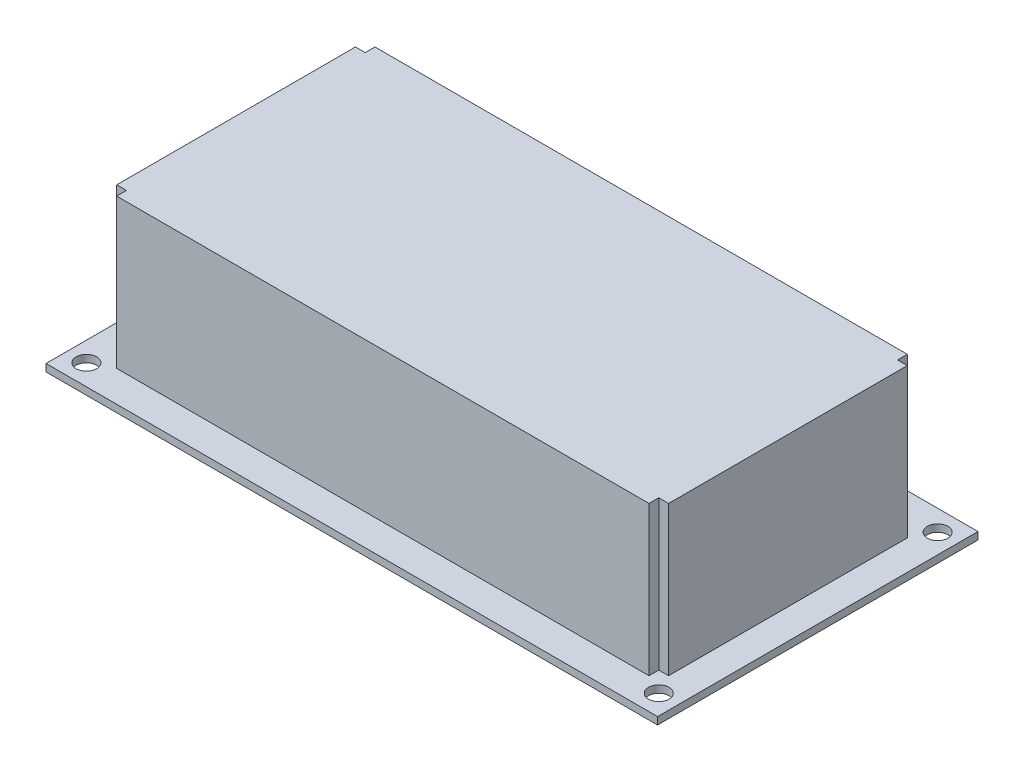
from build123d import *

# Parameters (mm, degrees)
SKETCH_1_W        = 125
SKETCH_1_H        = 65.5
EXTRUDE_1_DEPTH   = 1.5
HOLE_WIZARD_M41_D = 4.2
EXTRUDE_2_DEPTH   = 30.5


with BuildPart() as part:
    # Эскиз1 → Бобышка-Вытянуть1 (new body)
    with BuildSketch(Plane(origin=(0, 0, 0), x_dir=(1, 0, 0), z_dir=(0, 1, 0))):
        Rectangle(SKETCH_1_W, SKETCH_1_H)
    extrude(amount=EXTRUDE_1_DEPTH)

    # Сверло под метчик  спиральное M41 (through all)
    with Locations(Plane(origin=(0, 1.5, 0), x_dir=(1, 0, 0), z_dir=(0, 1, 0))):
        with Locations((-58.5, -28.5), (-58.5, 28.5), (58.5, 28.5), (58.5, -28.5)):
            Hole(HOLE_WIZARD_M41_D / 2)

    # Эскиз6 → Бобышка-Вытянуть2 (add)
    with BuildSketch(Plane(origin=(0, 1.5, 0), x_dir=(1, 0, 0), z_dir=(0, 1, 0))):
        Polygon((56.4, -24.4), (54.4, -24.4), (54.4, -26.4), (-54.4, -26.4), (-54.4, -24.4), (-56.4, -24.4), (-56.4, 24.4), (-54.4, 24.4), (-54.4, 26.4), (54.4, 26.4), (54.4, 24.4), (56.4, 24.4), align=None)
    extrude(amount=EXTRUDE_2_DEPTH)


solid = part.part
